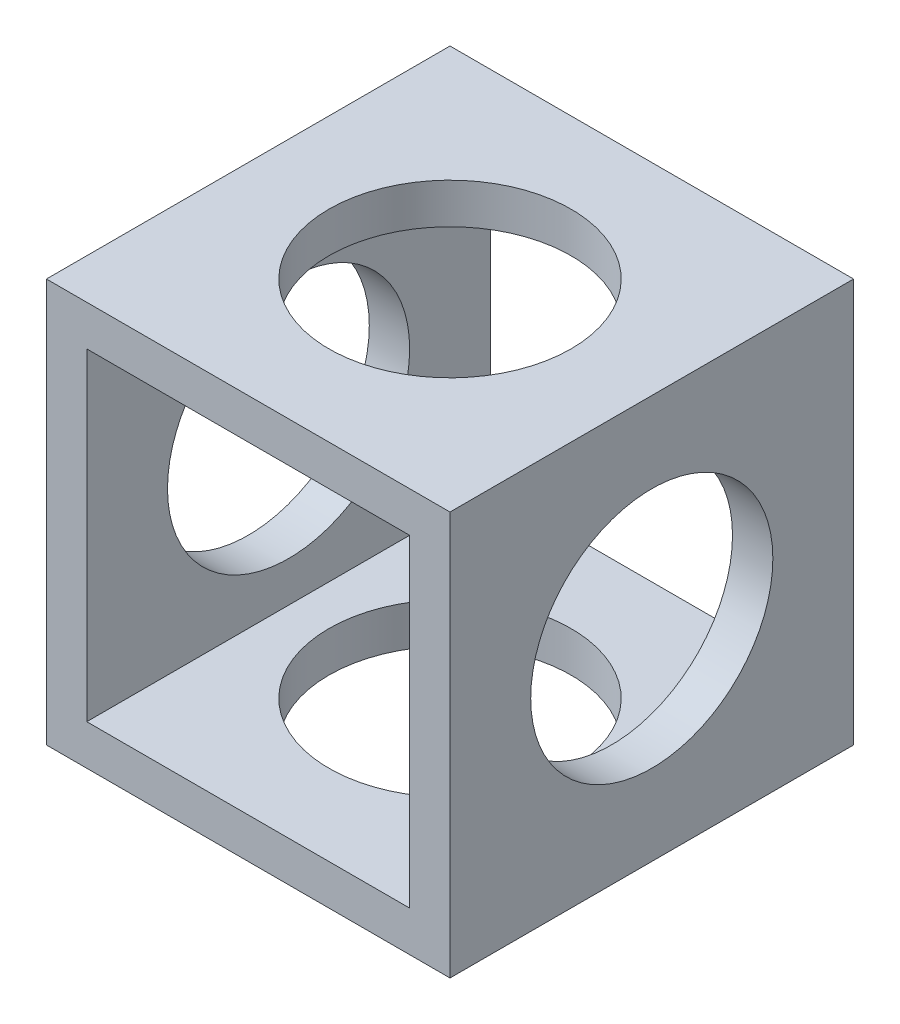
from build123d import *

# Parameters (mm, degrees)
CROQUIS1_W              = 50
CROQUIS1_H              = 50
CROQUIS1_W_2            = 40
CROQUIS1_H_2            = 40
SALIENTE_EXTRUIR1_DEPTH = 50
CROQUIS2_R              = 15
CORTAR_EXTRUIR1_DEPTH   = 76
CROQUIS3_R              = 15
CORTAR_EXTRUIR2_DEPTH   = 76


with BuildPart() as part:
    # Croquis1 → Saliente-Extruir1 (new body)
    with BuildSketch(Plane.XY):
        Rectangle(CROQUIS1_W, CROQUIS1_H)
        Rectangle(CROQUIS1_W_2, CROQUIS1_H_2, mode=Mode.SUBTRACT)
    extrude(amount=-SALIENTE_EXTRUIR1_DEPTH)

    # Croquis2 → Cortar-Extruir1 (cut, through all)
    with BuildSketch(Plane(origin=(0, 25, 0), x_dir=(1, 0, 0), z_dir=(0, 1, 0))):
        with Locations(Location((0, 25, 0), (0, 0, 180))):
            Circle(CROQUIS2_R)
    extrude(amount=-CORTAR_EXTRUIR1_DEPTH, mode=Mode.SUBTRACT)

    # Croquis3 → Cortar-Extruir2 (cut, through all)
    with BuildSketch(Plane(origin=(25, 0, 0), x_dir=(0, 0, -1), z_dir=(1, 0, 0))):
        with Locations((25, 0)):
            Circle(CROQUIS3_R)
    extrude(amount=-CORTAR_EXTRUIR2_DEPTH, mode=Mode.SUBTRACT)


solid = part.part
